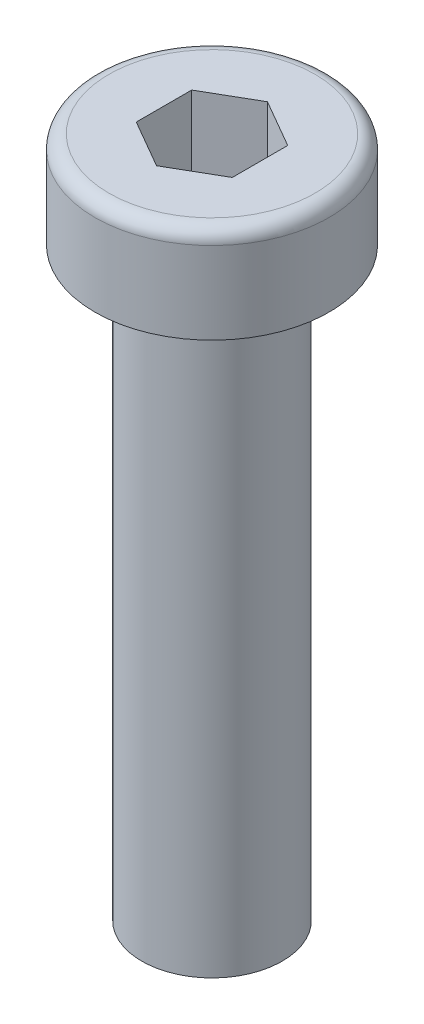
from build123d import *

# Parameters (mm, degrees)
SKETCH1_R           = 5
BOSS_EXTRUDE1_DEPTH = 4.1
FILLET1_R           = 0.6
CUT_EXTRUDE1_DEPTH  = 3.6
SKETCH3_R           = 3
BOSS_EXTRUDE2_DEPTH = 25


with BuildPart() as part:
    # Sketch1 → Boss-Extrude1 (new body)
    with BuildSketch(Plane(origin=(0, 0, 0), x_dir=(1, 0, 0), z_dir=(0, 1, 0))):
        with Locations(Location((0, 0, 0), (0, 0, 270))):
            Circle(SKETCH1_R)
    extrude(amount=BOSS_EXTRUDE1_DEPTH)

    # Fillet1
    fillet1_edges = [part.edges().sort_by_distance(p)[0] for p in [
        (0, 4.1, -5),
    ]]
    fillet(fillet1_edges, radius=FILLET1_R)

    # Sketch2 → Cut-Extrude1 (cut)
    with BuildSketch(Plane(origin=(0, 4.1, 0), x_dir=(1, 0, 0), z_dir=(0, 1, 0))):
        Polygon((0, -2.367136104), (2.05, -1.183568052), (2.05, 1.183568052), (0, 2.367136104), (-2.05, 1.183568052), (-2.05, -1.183568052), align=None)
    extrude(amount=-CUT_EXTRUDE1_DEPTH, mode=Mode.SUBTRACT)

    # Sketch3 → Boss-Extrude2 (add)
    with BuildSketch(Plane.XZ):
        with Locations(Location((0, 0, 0), (0, 0, 270))):
            Circle(SKETCH3_R)
    extrude(amount=BOSS_EXTRUDE2_DEPTH)


solid = part.part
